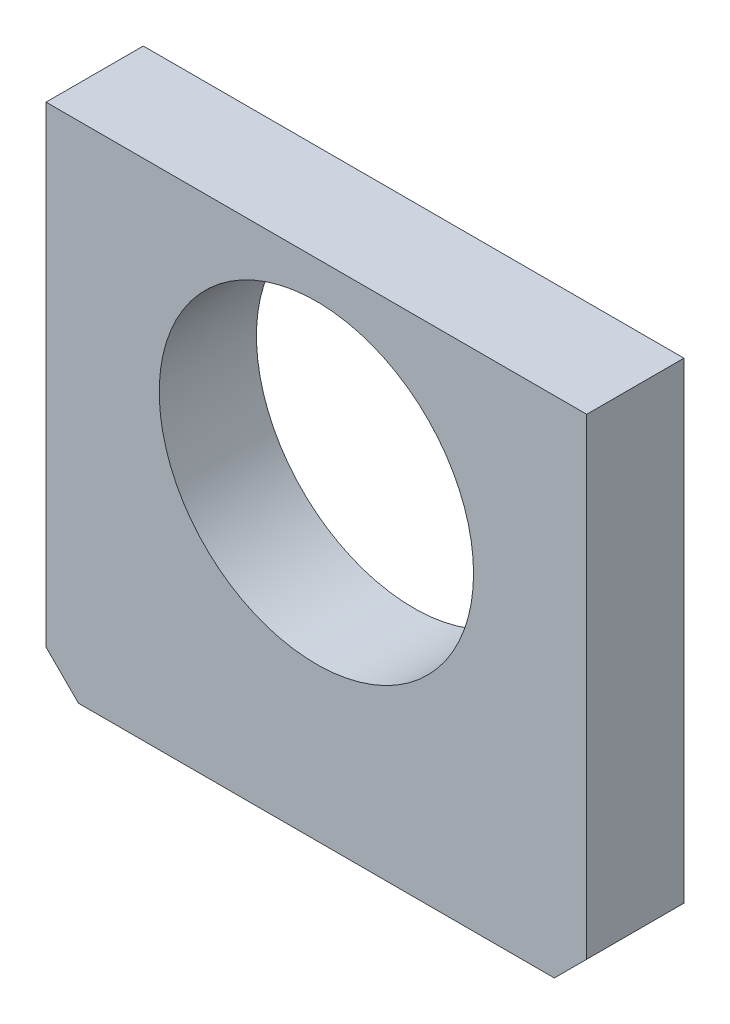
from build123d import *

# Parameters (mm, degrees)
SKETCH1_W           = 105.949999994
SKETCH1_H           = 98.843650928
BOSS_EXTRUDE1_DEPTH = 19.05
SKETCH2_R           = 30.7975
CUT_EXTRUDE1_DEPTH  = 499.69403033
CHAMFER1_SIZE       = 6.35


with BuildPart() as part:
    # Sketch1 → Boss-Extrude1 (new body)
    with BuildSketch(Plane.XY):
        with Locations((0, 446.084463863)):
            Rectangle(SKETCH1_W, SKETCH1_H)
    extrude(amount=-BOSS_EXTRUDE1_DEPTH)

    # Sketch2 → Cut-Extrude1 (cut, through all)
    with BuildSketch(Plane.XY):
        with Locations((0, 457.406289235)):
            Circle(SKETCH2_R)
    extrude(amount=-CUT_EXTRUDE1_DEPTH, mode=Mode.SUBTRACT)

    # Chamfer1
    chamfer1_edges = [part.edges().sort_by_distance(p)[0] for p in [
        (52.974999997, 396.662638399, -9.525),
        (-52.974999997, 396.662638399, -9.525),
    ]]
    chamfer(chamfer1_edges, length=CHAMFER1_SIZE)


solid = part.part
